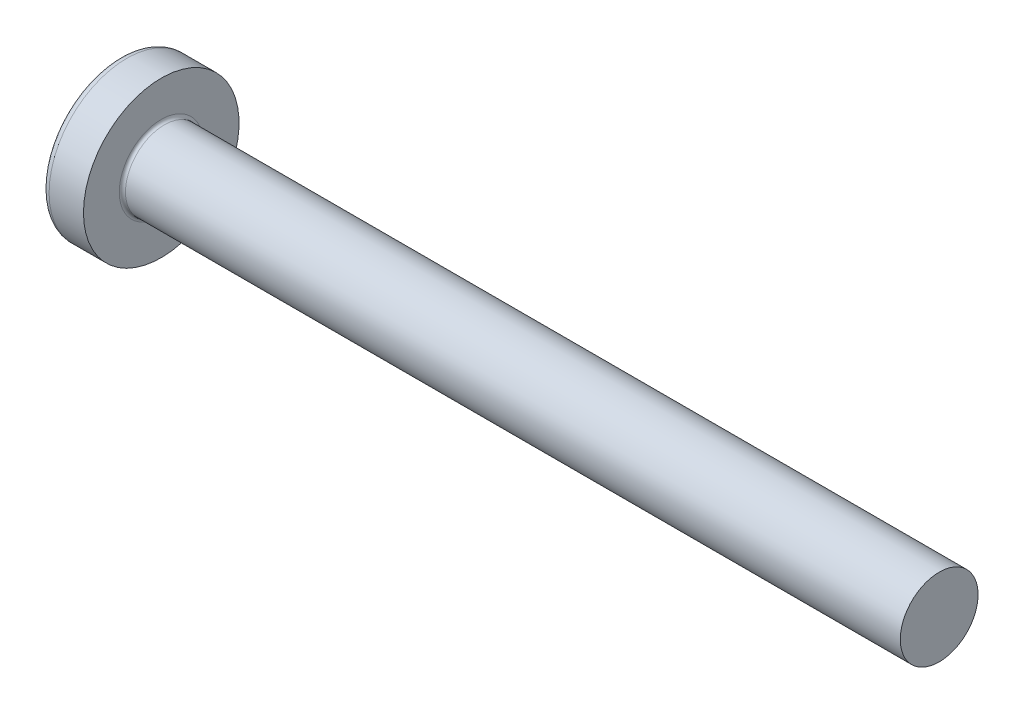
from build123d import *

# Parameters (mm, degrees)
FILLET1_R    = 0.1
RECPAT_COUNT = 2
RECPAT_ANGLE = 90


with BuildPart() as part:
    # BodySke → Base-Revolve (revolve)
    with BuildSketch(Plane.XY, mode=Mode.PRIVATE) as base_revolve_sk:
        with BuildLine():
            Line((2.1, 1.25), (2.1, 2.5))
            Line((2.1, 2.5), (0.99500416, 2.5))
            ThreePointArc((0.99500416, 2.5), (0.88781572, 2.474733878), (0.803195915, 2.404255319))
            ThreePointArc((0.803195915, 2.404255319), (0.206109099, 1.267435138), (0, 0))
            Line((0, 0), (27.1, 0))
            Line((27.1, 0), (27.1, 1.25))
            Line((27.1, 1.25), (2.1, 1.25))
        make_face()
    revolve(base_revolve_sk.sketch.rotate(Axis((0.99500416, 0, 0), (1, 0, 0)), 90), axis=Axis((0.99500416, 0, 0), (1, 0, 0)))

    # Fillet1
    fillet1_edges = [part.edges().sort_by_distance(p)[0] for p in [
        (2.1, 0, -1.25),
    ]]
    fillet(fillet1_edges, radius=FILLET1_R)

    # Sketch3 → Recess section 0
    with BuildSketch(Plane(origin=(0, 0, 0), x_dir=(0, 0, -1), z_dir=(1, 0, 0))):
        with BuildLine():
            Line((0.37, -1.3), (-0.37, -1.3))
            Line((-0.37, -1.3), (-0.37, 1.3))
            Line((-0.37, 1.3), (0.37, 1.3))
            Line((0.37, 1.3), (0.37, -1.3))
        make_face()
    # Sketch4 → Recess section 1
    with BuildSketch(Plane(origin=(1.5, 0, 0), x_dir=(0, 0, -1), z_dir=(1, 0, 0))):
        with BuildLine():
            Line((0.37, -0.552127614), (-0.37, -0.552127614))
            Line((-0.37, -0.552127614), (-0.37, 0.552127614))
            Line((-0.37, 0.552127614), (0.37, 0.552127614))
            Line((0.37, 0.552127614), (0.37, -0.552127614))
        make_face()
    recess = loft(mode=Mode.SUBTRACT)

    # RecPat: Recess ×2 about axis
    recpat_axis = Axis((0, 0, 0), (1, 0, 0))
    for i in range(1, RECPAT_COUNT):
        add(recess.rotate(recpat_axis, i * RECPAT_ANGLE / (RECPAT_COUNT - 1)), mode=Mode.SUBTRACT)

    # RecCorSke → RecessCore (revolve, cut)
    with BuildSketch(Plane.XY, mode=Mode.PRIVATE) as recesscore_sk:
        Polygon((0, 0), (0, 0.660890218), (1.5, 0.556), (1.680655351, 0), align=None)
    revolve(recesscore_sk.sketch.rotate(Axis((-3.175, 0, 0), (1, 0, 0)), 17.145865586), axis=Axis((-3.175, 0, 0), (1, 0, 0)), mode=Mode.SUBTRACT)


solid = part.part
